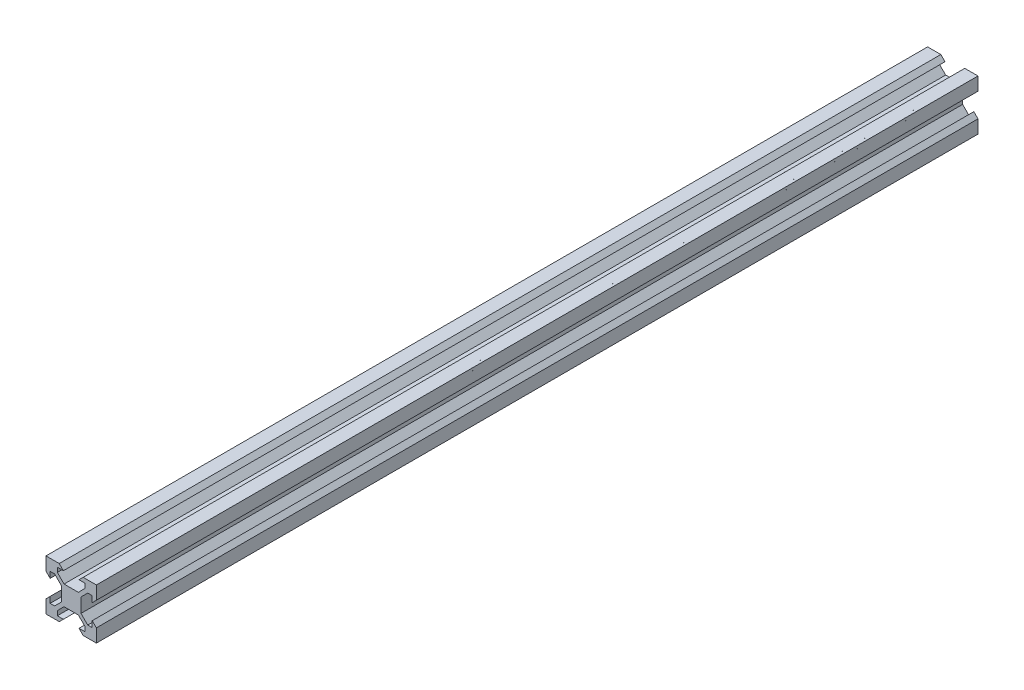
from build123d import *

# Parameters (mm, degrees)
BOSS_EXTRUDE1_DEPTH = 350


with BuildPart() as part:
    # Sketch1 → Boss-Extrude1 (new body)
    with BuildSketch(Plane.XY):
        Polygon((2.834320347, 3.893970342), (-2.834320347, 3.893970342), (-5.5, 6.558849663), (-5.5, 8.349069506), (-3.1, 8.349069506), (-4.75, 9.998574117), (-10, 9.998574117), (-10, 4.746997406), (-8.35, 3.097492795), (-8.350720674, 5.497492687), (-6.560500912, 5.498030255), (-3.894821259, 2.833150935), (-3.894821259, -2.833150935), (-6.560500912, -5.498030255), (-8.350720674, -5.497492687), (-8.35, -3.097492795), (-10, -4.746997406), (-10, -9.998574117), (-4.75, -9.998574117), (-3.1, -8.349069506), (-5.5, -8.349069506), (-5.5, -6.558849663), (-2.834320347, -3.893970342), (2.834320347, -3.893970342), (5.5, -6.558849663), (5.5, -8.349069506), (3.1, -8.349069506), (4.75, -9.998574117), (10, -9.998574117), (10, -4.746997406), (8.35, -3.097492795), (8.350720674, -5.497492687), (6.560500912, -5.498030255), (3.894821259, -2.833150935), (3.894821259, 2.833150935), (6.560500912, 5.498030255), (8.350720674, 5.497492687), (8.35, 3.097492795), (10, 4.746997406), (10, 9.998574117), (4.75, 9.998574117), (3.1, 8.349069506), (5.5, 8.349069506), (5.5, 6.558849663), align=None)
    extrude(amount=BOSS_EXTRUDE1_DEPTH)


solid = part.part
